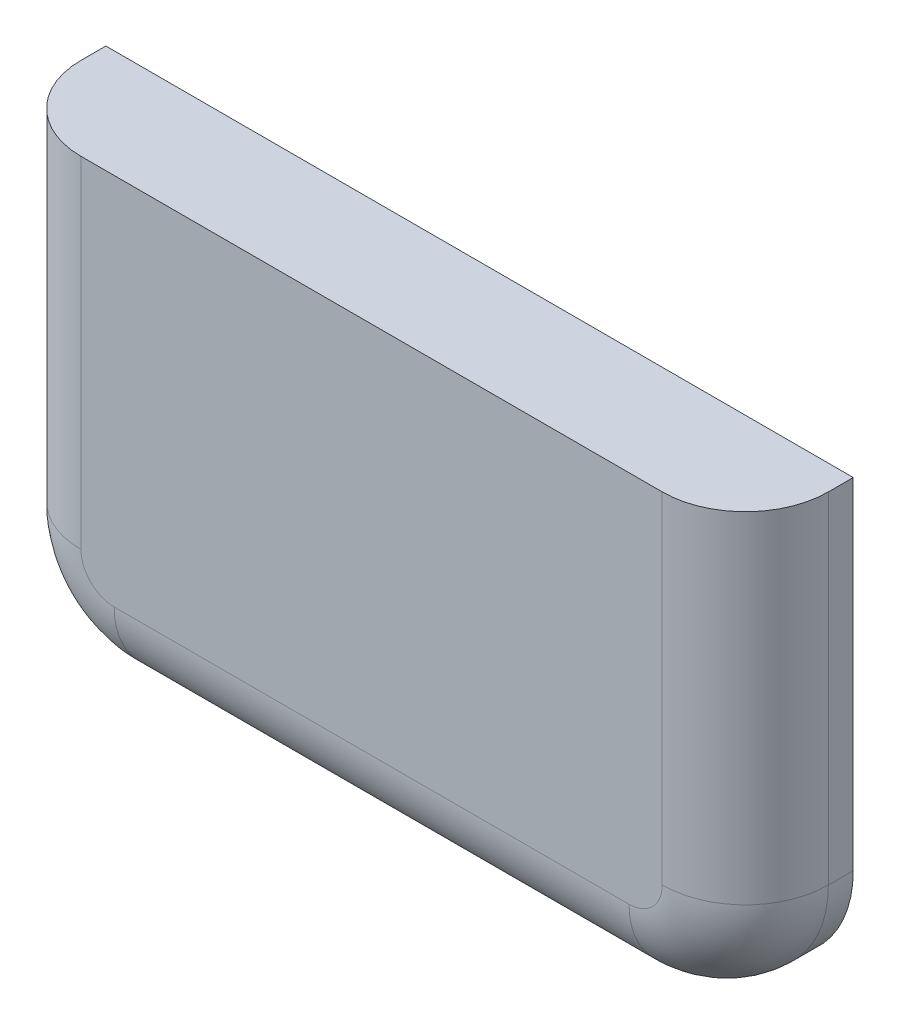
from build123d import *

# Parameters (mm, degrees)
CROQUIS1_W              = 450
CROQUIS1_H              = 275
SALIENTE_EXTRUIR1_DEPTH = 65
REDONDEO1_R             = 70
REDONDEO2_R             = 70
REDONDEO3_R             = 50


with BuildPart() as part:
    # Croquis1 → Saliente-Extruir1 (new body)
    with BuildSketch(Plane.XY):
        Rectangle(CROQUIS1_W, CROQUIS1_H)
    extrude(amount=SALIENTE_EXTRUIR1_DEPTH)

    # Redondeo1
    redondeo1_edges = [part.edges().sort_by_distance(p)[0] for p in [
        (-225, -137.5, 32.5),
    ]]
    fillet(redondeo1_edges, radius=REDONDEO1_R)

    # Redondeo2
    redondeo2_edges = [part.edges().sort_by_distance(p)[0] for p in [
        (225, -137.5, 32.5),
    ]]
    fillet(redondeo2_edges, radius=REDONDEO2_R)

    # Redondeo3
    redondeo3_edges = [part.edges().sort_by_distance(p)[0] for p in [
        (0, -137.5, 65),
        (-225, 35, 65),
        (-204.497474683, -116.997474683, 65),
        (225, 35, 65),
        (204.497474683, -116.997474683, 65),
    ]]
    fillet(redondeo3_edges, radius=REDONDEO3_R)


solid = part.part
